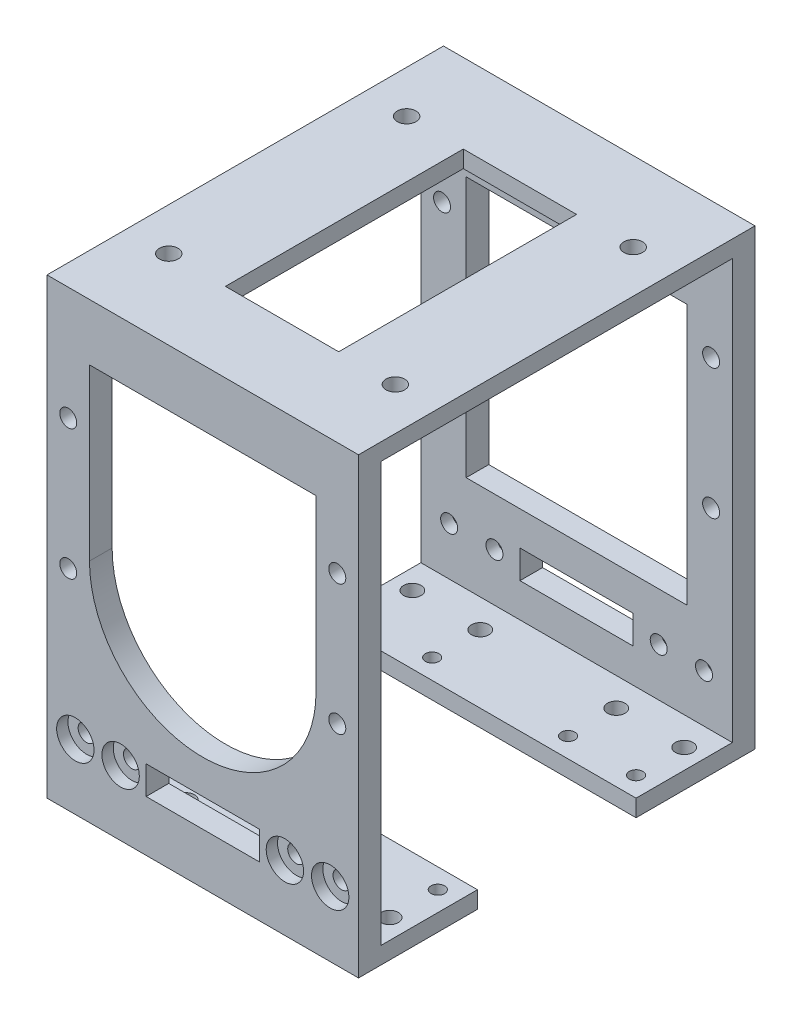
from build123d import *

# Parameters (mm, degrees)
SKETCH1_W                 = 75
SKETCH1_H                 = 40
SKETCH1_R                 = 5
SKETCH1_R_2               = 1.7
SKETCH1_W_2               = 10
SKETCH1_H_2               = 20
BOSS_EXTRUDE1_DEPTH       = 3
CUT_EXTRUDE1_DEPTH        = 43.605750786
CUT_EXTRUDE1_DEPTH_BACK   = 43.605750786
SKETCH2_W                 = 67
SKETCH2_H                 = 28
BOSS_EXTRUDE3_DEPTH       = 110
BOSS_EXTRUDE3_DEPTH_BACK  = 3
SKETCH6_W                 = 67
SKETCH6_H                 = 11
CUT_EXTRUDE4_DEPTH        = 122.372360939
SKETCH7_W                 = 70
SKETCH7_H                 = 37
BOSS_EXTRUDE4_DEPTH       = 45
SKETCH8_W                 = 45
SKETCH8_H                 = 62
CUT_EXTRUDE6_DEPTH        = 29
SKETCH11_W                = 45
SKETCH11_H                = 4
CUT_EXTRUDE9_DEPTH        = 157.445677473
SKETCH9_W                 = 38
SKETCH9_H                 = 28.5
CUT_EXTRUDE10_DEPTH       = 204.024629048
SKETCH13_W                = 5
SKETCH13_H                = 38
BOSS_EXTRUDE5_DEPTH       = 32
SKETCH14_R                = 5
SKETCH14_R_2              = 1.7
CUT_EXTRUDE11_DEPTH       = 32
SKETCH15_W                = 165
SKETCH15_H                = 70
SKETCH15_W_2              = 157
SKETCH15_H_2              = 62
BOSS_EXTRUDE6_DEPTH       = 3
SKETCH16_W                = 20
SKETCH16_H                = 5
CUT_EXTRUDE12_DEPTH       = 159.626132778
SKETCH18_R                = 5
CUT_EXTRUDE14_DEPTH       = 159.626132778
MIRROR6_COPY_1_SKETCH_W   = 5
MIRROR6_COPY_1_SKETCH_H   = 38
MIRROR6_COPY_1_DEPTH      = 32
MIRROR6_COPY_2_SKETCH_R   = 5
MIRROR6_COPY_2_SKETCH_R_2 = 1.7
MIRROR6_COPY_2_DEPTH      = 32
SKETCH19_W                = 38
SKETCH19_H                = 3.5
CUT_EXTRUDE15_DEPTH       = 10
SKETCH20_R                = 1.2
CUT_EXTRUDE16_DEPTH       = 10
SKETCH21_W                = 10
SKETCH21_H                = 80
CUT_EXTRUDE17_DEPTH       = 184.330984833
SKETCH22_W                = 172.739058827
SKETCH22_H                = 75.843231067
CUT_EXTRUDE18_DEPTH       = 184.330984833
SKETCH23_W                = 55
SKETCH23_H                = 70
BOSS_EXTRUDE7_DEPTH       = 3
SKETCH24_R                = 10
SKETCH24_R_2              = 1.65
CUT_EXTRUDE19_DEPTH       = 3
SKETCH25_R                = 1.55
CUT_EXTRUDE20_DEPTH       = 10
SKETCH27_W                = 39
SKETCH27_H                = 46
CUT_EXTRUDE21_DEPTH       = 4
SKETCH29_W                = 20
SKETCH29_H                = 42
CUT_EXTRUDE22_DEPTH       = 10
SKETCH31_R                = 1.5
CUT_EXTRUDE23_DEPTH       = 110.80095628
SKETCH32_R                = 3.3
CUT_EXTRUDE24_DEPTH       = 2
CUT_EXTRUDE25_DEPTH       = 10
SKETCH34_R                = 1.5
CUT_EXTRUDE26_DEPTH       = 110.80095628


with BuildPart() as part:
    # Sketch1 → Boss-Extrude1 (new body)
    with BuildSketch(Plane(origin=(0, 0, 0), x_dir=(1, 0, 0), z_dir=(0, 1, 0))):
        Rectangle(SKETCH1_W, SKETCH1_H)
        with Locations(Location((-21, 0, 0), (0, 0, 270))):
            Circle(SKETCH1_R, mode=Mode.SUBTRACT)
        with Locations(Location((-30, 8.25, 0), (0, 0, 270))):
            Circle(SKETCH1_R_2, mode=Mode.SUBTRACT)
        with Locations(Location((-12, 8.25, 0), (0, 0, 270))):
            Circle(SKETCH1_R_2, mode=Mode.SUBTRACT)
        with Locations(Location((-12, -8.25, 0), (0, 0, 270))):
            Circle(SKETCH1_R_2, mode=Mode.SUBTRACT)
        with Locations(Location((-30, -8.25, 0), (0, 0, 270))):
            Circle(SKETCH1_R_2, mode=Mode.SUBTRACT)
        with Locations(Location((12, 8.25, 0), (0, 0, 90))):
            Circle(SKETCH1_R_2, mode=Mode.SUBTRACT)
        with Locations(Location((12, -8.25, 0), (0, 0, 90))):
            Circle(SKETCH1_R_2, mode=Mode.SUBTRACT)
        with Locations(Location((21, 0, 0), (0, 0, 90))):
            Circle(SKETCH1_R, mode=Mode.SUBTRACT)
        with Locations(Location((30, -8.25, 0), (0, 0, 90))):
            Circle(SKETCH1_R_2, mode=Mode.SUBTRACT)
        with Locations(Location((30, 8.25, 0), (0, 0, 90))):
            Circle(SKETCH1_R_2, mode=Mode.SUBTRACT)
        Rectangle(SKETCH1_W_2, SKETCH1_H_2, mode=Mode.SUBTRACT)
    extrude(amount=BOSS_EXTRUDE1_DEPTH)

    # Sketch2 → Cut-Extrude1 (cut, two sides: drawn at the far end of the back side and taken through both)
    with BuildSketch(Plane(origin=(0, 3, 0), x_dir=(1, 0, 0), z_dir=(0, 1, 0)).offset(-CUT_EXTRUDE1_DEPTH_BACK)):
        Rectangle(SKETCH2_W, SKETCH2_H)
    extrude(amount=CUT_EXTRUDE1_DEPTH + CUT_EXTRUDE1_DEPTH_BACK, mode=Mode.SUBTRACT)

    # Sketch3 → Boss-Extrude3 (add, two sides: drawn at the far end of the back side and taken through both)
    with BuildSketch(Plane(origin=(0, 3, 0), x_dir=(1, 0, 0), z_dir=(0, 1, 0)).offset(-BOSS_EXTRUDE3_DEPTH_BACK)):
        Polygon((37.5, -35), (37.5, -20), (33.5, -20), (-33.5, -20), (-37.5, -20), (-37.5, -35), align=None)
        Polygon((33.5, 20), (37.5, 20), (37.5, 35), (-37.5, 35), (-37.5, 20), (-33.5, 20), align=None)
        Polygon((37.5, -20), (37.5, 20), (33.5, 20), (33.5, 14), (33.5, -14), (33.5, -20), align=None)
        Polygon((-33.5, 14), (-33.5, 20), (-37.5, 20), (-37.5, -20), (-33.5, -20), (-33.5, -14), align=None)
    extrude(amount=BOSS_EXTRUDE3_DEPTH + BOSS_EXTRUDE3_DEPTH_BACK)

    # Sketch6 → Cut-Extrude4 (cut, through all)
    with BuildSketch(Plane(origin=(0, 3, 0), x_dir=(1, 0, 0), z_dir=(0, 1, 0))):
        with Locations((0, -25.5)):
            Rectangle(SKETCH6_W, SKETCH6_H)
        with Locations((0, 25.5)):
            Rectangle(SKETCH6_W, SKETCH6_H)
    extrude(amount=CUT_EXTRUDE4_DEPTH, mode=Mode.SUBTRACT)

    # Sketch7 → Boss-Extrude4 (add)
    with BuildSketch(Plane.ZY.offset(37.5)):
        with Locations((0, 94.5)):
            Rectangle(SKETCH7_W, SKETCH7_H)
    boss_extrude4 = extrude(amount=BOSS_EXTRUDE4_DEPTH)

    # Mirror2: Boss-Extrude4 across plane
    add(boss_extrude4.mirror(Plane(origin=(0, 0, 0), x_dir=(0, 0, 1), z_dir=(1, 0, 0))))

    # Sketch8 → Cut-Extrude6 (cut)
    with BuildSketch(Plane(origin=(0, 113, 0), x_dir=(1, 0, 0), z_dir=(0, 1, 0))):
        with Locations((-56, 0)):
            Rectangle(SKETCH8_W, SKETCH8_H)
        with Locations((56, 0)):
            Rectangle(SKETCH8_W, SKETCH8_H)
    extrude(amount=-CUT_EXTRUDE6_DEPTH, mode=Mode.SUBTRACT)

    # Sketch11 → Cut-Extrude9 (cut, through all)
    with BuildSketch(Plane.XY.offset(35)):
        with Locations((-60, 78)):
            Rectangle(SKETCH11_W, SKETCH11_H)
        with Locations((60, 78)):
            Rectangle(SKETCH11_W, SKETCH11_H)
    extrude(amount=-CUT_EXTRUDE9_DEPTH, mode=Mode.SUBTRACT)

    # Sketch9 → Cut-Extrude10 (cut, through all)
    with BuildSketch(Plane.ZY.offset(82.5)):
        with Locations((0, 98.25)):
            Rectangle(SKETCH9_W, SKETCH9_H)
    extrude(amount=-CUT_EXTRUDE10_DEPTH, mode=Mode.SUBTRACT)

    # Sketch13 → Boss-Extrude5 (add)
    with BuildSketch(Plane(origin=(0, 84, 0), x_dir=(1, 0, 0), z_dir=(0, 1, 0))):
        with Locations((-54.5, 0)):
            Rectangle(SKETCH13_W, SKETCH13_H)
    boss_extrude5 = extrude(amount=BOSS_EXTRUDE5_DEPTH)

    # Sketch14 → Cut-Extrude11 (cut)
    with BuildSketch(Plane.ZY.offset(57)):
        with Locations((0, 98.25)):
            Circle(SKETCH14_R)
        with Locations((-9, 106.5)):
            Circle(SKETCH14_R_2)
        with Locations((9, 106.5)):
            Circle(SKETCH14_R_2)
        with Locations((9, 90)):
            Circle(SKETCH14_R_2)
        with Locations((-9, 90)):
            Circle(SKETCH14_R_2)
    cut_extrude11 = extrude(amount=-CUT_EXTRUDE11_DEPTH, mode=Mode.SUBTRACT)

    # Mirror4: Boss-Extrude5, Cut-Extrude11 across plane
    add(boss_extrude5.mirror(Plane(origin=(0, 0, 0), x_dir=(0, 0, 1), z_dir=(1, 0, 0))))
    add(cut_extrude11.mirror(Plane(origin=(0, 0, 0), x_dir=(0, 0, 1), z_dir=(1, 0, 0))), mode=Mode.SUBTRACT)

    # Sketch15 → Boss-Extrude6 (add)
    with BuildSketch(Plane(origin=(0, 113, 0), x_dir=(1, 0, 0), z_dir=(0, 1, 0))):
        Rectangle(SKETCH15_W, SKETCH15_H)
        Rectangle(SKETCH15_W_2, SKETCH15_H_2, mode=Mode.SUBTRACT)
    extrude(amount=BOSS_EXTRUDE6_DEPTH)

    # Sketch16 → Cut-Extrude12 (cut, through all)
    with BuildSketch(Plane.XY.offset(35)):
        with Locations((0, 11.5)):
            Rectangle(SKETCH16_W, SKETCH16_H)
    extrude(amount=-CUT_EXTRUDE12_DEPTH, mode=Mode.SUBTRACT)

    # Sketch18 → Cut-Extrude14 (cut, through all)
    with BuildSketch(Plane.XY.offset(35)):
        with Locations((67.75, 100)):
            Circle(SKETCH18_R)
    cut_extrude14 = extrude(amount=-CUT_EXTRUDE14_DEPTH, mode=Mode.SUBTRACT)

    # Mirror5: Cut-Extrude14 across plane
    add(cut_extrude14.mirror(Plane(origin=(0, 0, 0), x_dir=(0, 0, 1), z_dir=(1, 0, 0))), mode=Mode.SUBTRACT)

    # Mirror6: Boss-Extrude5, Cut-Extrude11 across plane
    add(boss_extrude5.mirror(Plane.ZX.offset(116)))
    add(cut_extrude11.mirror(Plane.ZX.offset(116)), mode=Mode.SUBTRACT)

    # Mirror6 copy 1 sketch → Mirror6 copy 1 (add)
    with BuildSketch(Plane(origin=(0, 148, 0), x_dir=(-1, 0, 0), z_dir=(0, -1, 0))):
        with Locations((-54.5, 0)):
            Rectangle(MIRROR6_COPY_1_SKETCH_W, MIRROR6_COPY_1_SKETCH_H)
    extrude(amount=MIRROR6_COPY_1_DEPTH)

    # Mirror6 copy 2 sketch → Mirror6 copy 2 (cut)
    with BuildSketch(Plane(origin=(57, 232, 0), x_dir=(0, 0, 1), z_dir=(1, 0, 0))):
        with Locations((0, 98.25)):
            Circle(MIRROR6_COPY_2_SKETCH_R)
        with Locations((-9, 106.5)):
            Circle(MIRROR6_COPY_2_SKETCH_R_2)
        with Locations((9, 106.5)):
            Circle(MIRROR6_COPY_2_SKETCH_R_2)
        with Locations((9, 90)):
            Circle(MIRROR6_COPY_2_SKETCH_R_2)
        with Locations((-9, 90)):
            Circle(MIRROR6_COPY_2_SKETCH_R_2)
    extrude(amount=-MIRROR6_COPY_2_DEPTH, mode=Mode.SUBTRACT)

    # Sketch19 → Cut-Extrude15 (cut)
    with BuildSketch(Plane(origin=(82.5, 0, 0), x_dir=(0, 0, -1), z_dir=(1, 0, 0))):
        with Locations((0, 114.25)):
            Rectangle(SKETCH19_W, SKETCH19_H)
    cut_extrude15 = extrude(amount=-CUT_EXTRUDE15_DEPTH, mode=Mode.SUBTRACT)

    # Mirror7: Cut-Extrude15 across plane
    add(cut_extrude15.mirror(Plane(origin=(0, 0, 0), x_dir=(0, 0, 1), z_dir=(1, 0, 0))), mode=Mode.SUBTRACT)

    # Sketch20 → Cut-Extrude16 (cut)
    with BuildSketch(Plane(origin=(0, 3, 0), x_dir=(1, 0, 0), z_dir=(0, 1, 0))):
        with Locations(Location((-24, 17.5, 0), (0, 0, 270))):
            Circle(SKETCH20_R)
        with Locations(Location((-12, 17.5, 0), (0, 0, 270))):
            Circle(SKETCH20_R)
        with Locations(Location((12, 17.5, 0), (0, 0, 270))):
            Circle(SKETCH20_R)
        with Locations(Location((-24, -17.5, 0), (0, 0, 270))):
            Circle(SKETCH20_R)
        with Locations(Location((-12, -17.5, 0), (0, 0, 270))):
            Circle(SKETCH20_R)
        with Locations(Location((24, 17.5, 0), (0, 0, 270))):
            Circle(SKETCH20_R)
        with Locations(Location((12, -17.5, 0), (0, 0, 270))):
            Circle(SKETCH20_R)
        with Locations(Location((24, -17.5, 0), (0, 0, 270))):
            Circle(SKETCH20_R)
    extrude(amount=-CUT_EXTRUDE16_DEPTH, mode=Mode.SUBTRACT)

    # Sketch21 → Cut-Extrude17 (cut, through all)
    with BuildSketch(Plane.XY.offset(35)):
        with Locations((32.5, 40)):
            Rectangle(SKETCH21_W, SKETCH21_H)
        with Locations((-32.5, 40)):
            Rectangle(SKETCH21_W, SKETCH21_H)
    extrude(amount=-CUT_EXTRUDE17_DEPTH, mode=Mode.SUBTRACT)

    # Sketch22 → Cut-Extrude18 (cut, through all)
    with BuildSketch(Plane.XY.offset(35)):
        with Locations((-3.869529414, 117.921615534)):
            Rectangle(SKETCH22_W, SKETCH22_H)
    extrude(amount=-CUT_EXTRUDE18_DEPTH, mode=Mode.SUBTRACT)


with BuildPart() as cut_extrude18_piece_1:
    # of the separate pieces the step leaves, piece 1, a body of its own (cut_extrude18_pieces)
    add(part.part.solids().sort_by_distance((-27.5, 0, 35))[0])



with BuildPart() as cut_extrude18_piece_2:
    # of the separate pieces the step leaves, piece 2, a body of its own (cut_extrude18_pieces)
    add(part.part.solids().sort_by_distance((27.5, 0, -35))[0])


with BuildPart() as cut_extrude18_piece_1_1:
    add(cut_extrude18_piece_1.part)

    add(cut_extrude18_piece_2.part)  # Boss-Extrude7 merges Cut-Extrude18 piece 2
    # Sketch23 → Boss-Extrude7 (add)
    with BuildSketch(Plane(origin=(0, 80, 0), x_dir=(1, 0, 0), z_dir=(0, 1, 0))):
        Rectangle(SKETCH23_W, SKETCH23_H)
    extrude(amount=-BOSS_EXTRUDE7_DEPTH)

    # Sketch24 → Cut-Extrude19 (cut)
    with BuildSketch(Plane(origin=(0, 80, 0), x_dir=(1, 0, 0), z_dir=(0, 1, 0))):
        with Locations(Location((0, 0, 0), (0, 0, 270))):
            Circle(SKETCH24_R)
        with Locations(Location((-20, 21, 0), (0, 0, 270))):
            Circle(SKETCH24_R_2)
        with Locations(Location((-20, -21, 0), (0, 0, 270))):
            Circle(SKETCH24_R_2)
        with Locations(Location((20, -21, 0), (0, 0, 90))):
            Circle(SKETCH24_R_2)
        with Locations(Location((20, 21, 0), (0, 0, 90))):
            Circle(SKETCH24_R_2)
    extrude(amount=-CUT_EXTRUDE19_DEPTH, mode=Mode.SUBTRACT)

    # Sketch25 → Cut-Extrude20 (cut)
    with BuildSketch(Plane.XZ):
        with Locations(Location((-24, 26, 0), (0, 0, 270))):
            Circle(SKETCH25_R)
        with Locations(Location((12, -26, 0), (0, 0, 270))):
            Circle(SKETCH25_R)
        with Locations(Location((24, -26, 0), (0, 0, 270))):
            Circle(SKETCH25_R)
        with Locations(Location((12, 26, 0), (0, 0, 90))):
            Circle(SKETCH25_R)
        with Locations(Location((-12, 26, 0), (0, 0, 270))):
            Circle(SKETCH25_R)
        with Locations(Location((-24, -26, 0), (0, 0, 90))):
            Circle(SKETCH25_R)
        with Locations(Location((-12, -26, 0), (0, 0, 90))):
            Circle(SKETCH25_R)
        with Locations(Location((24, 26, 0), (0, 0, 90))):
            Circle(SKETCH25_R)
    extrude(amount=-CUT_EXTRUDE20_DEPTH, mode=Mode.SUBTRACT)

    # Sketch27 → Cut-Extrude21 (cut)
    with BuildSketch(Plane(origin=(0, 0, -35), x_dir=(-1, 0, 0), z_dir=(0, 0, -1))):
        with Locations((0, 43)):
            Rectangle(SKETCH27_W, SKETCH27_H)
    extrude(amount=-CUT_EXTRUDE21_DEPTH, mode=Mode.SUBTRACT)

    # Sketch29 → Cut-Extrude22 (cut)
    with BuildSketch(Plane(origin=(0, 80, 0), x_dir=(1, 0, 0), z_dir=(0, 1, 0))):
        Rectangle(SKETCH29_W, SKETCH29_H)
    extrude(amount=-CUT_EXTRUDE22_DEPTH, mode=Mode.SUBTRACT)

    # Sketch31 → Cut-Extrude23 (cut, through all)
    with BuildSketch(Plane(origin=(0, 0, -35), x_dir=(-1, 0, 0), z_dir=(0, 0, -1))):
        with Locations((22.5, 11.5)):
            Circle(SKETCH31_R)
        with Locations((14.5, 11.5)):
            Circle(SKETCH31_R)
        with Locations((-14.5, 11.5)):
            Circle(SKETCH31_R)
        with Locations((-22.5, 11.5)):
            Circle(SKETCH31_R)
    extrude(amount=-CUT_EXTRUDE23_DEPTH, mode=Mode.SUBTRACT)

    # Sketch32 → Cut-Extrude24 (cut)
    with BuildSketch(Plane(origin=(0, 0, -35), x_dir=(-1, 0, 0), z_dir=(0, 0, -1))):
        with Locations((-22.5, 11.5)):
            Circle(SKETCH32_R)
        with Locations((-14.5, 11.5)):
            Circle(SKETCH32_R)
        with Locations(Location((14.5, 11.5, 0), (0, 0, 180))):
            Circle(SKETCH32_R)
        with Locations(Location((22.5, 11.5, 0), (0, 0, 180))):
            Circle(SKETCH32_R)
    cut_extrude24 = extrude(amount=-CUT_EXTRUDE24_DEPTH, mode=Mode.SUBTRACT)

    # Mirror8: Cut-Extrude24 across plane
    add(cut_extrude24.mirror(Plane(origin=(0, 0, 0), x_dir=(1, 0, 0), z_dir=(0, 0, -1))), mode=Mode.SUBTRACT)

    # Sketch33 → Cut-Extrude25 (cut)
    with BuildSketch(Plane.XY.offset(35)):
        with BuildLine():
            Line((-20, 70), (-20, 40))
            ThreePointArc((-20, 40), (0, 60), (20, 40))
            Line((20, 40), (20, 70))
            Line((20, 70), (-20, 70))
        make_face()
        with BuildLine():
            ThreePointArc((20, 40), (0, 60), (-20, 40))
            Line((-20, 40), (20, 40))
        make_face()
        with BuildLine():
            Line((20, 40), (-20, 40))
            ThreePointArc((-20, 40), (0, 20), (20, 40))
        make_face()
    extrude(amount=-CUT_EXTRUDE25_DEPTH, mode=Mode.SUBTRACT)

    # Sketch34 → Cut-Extrude26 (cut, through all)
    with BuildSketch(Plane.XY.offset(35)):
        with Locations((-23.75, 60)):
            Circle(SKETCH34_R)
        with Locations((23.75, 60)):
            Circle(SKETCH34_R)
        with Locations((-23.75, 37)):
            Circle(SKETCH34_R)
        with Locations((23.75, 37)):
            Circle(SKETCH34_R)
    extrude(amount=-CUT_EXTRUDE26_DEPTH, mode=Mode.SUBTRACT)


solid = cut_extrude18_piece_1_1.part
